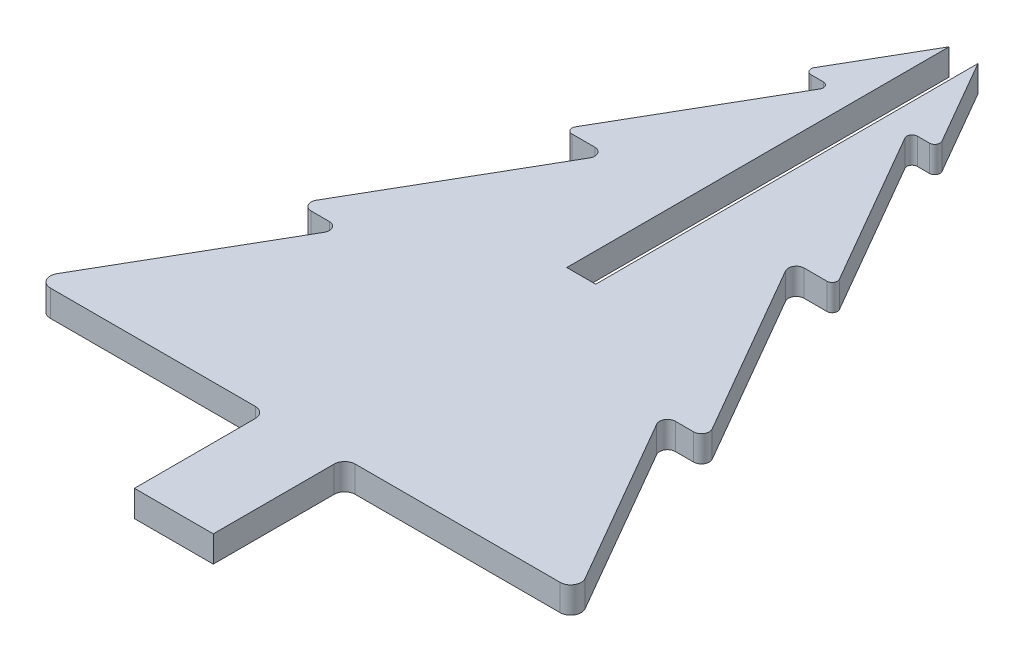
from build123d import *

# Parameters (mm, degrees)
ESBO_O1_W     = 15
ESBO_O1_H     = 25
RVORE_DEPTH   = 5
ESBO_O3_W     = 5.5
ESBO_O3_H     = 77.5
ENCAIXE_DEPTH = 5
FILETE1_R     = 1.5
FILETE2_R     = 1
FILETE3_R     = 1.5
FILETE4_R     = 1.5
FILETE5_R     = 2
FILETE6_R     = 1
FILETE7_R     = 1
FILETE8_R     = 2
FILETE9_R     = 1.5
FILETE10_R    = 1.5
FILETE11_R    = 1.5
FILETE12_R    = 1
FILETE13_R    = 1
FILETE14_R    = 1
FILETE15_R    = 2
FILETE16_R    = 2


with BuildPart() as part:
    # Esboço1 → rvore (new body)
    with BuildSketch(Plane(origin=(0, 0, 0), x_dir=(1, 0, 0), z_dir=(0, 1, 0))):
        with Locations((0, -127.5)):
            Rectangle(ESBO_O1_W, ESBO_O1_H)
        Polygon((-51.961524227, -115), (-7.5, -115), (7.5, -115), (51.961524227, -115), (30.310889132, -77.5), (-30.310889132, -77.5), align=None)
        Polygon((-8.660254038, -40), (-30.310889132, -77.5), (30.310889132, -77.5), (8.660254038, -40), align=None)
        Polygon((-17.320508076, -40), (-8.660254038, -40), (0, -25), (8.660254038, -40), (17.320508076, -40), (0, -10), align=None)
        Polygon((8.660254038, -40), (30.310889132, -77.5), (38.97114317, -77.5), (17.320508076, -40), align=None)
        Polygon((0, -25), (-8.660254038, -40), (8.660254038, -40), align=None)
        Polygon((-38.97114317, -77.5), (-30.310889132, -77.5), (-8.660254038, -40), (-17.320508076, -40), align=None)
        Polygon((-25.980762114, -40), (-17.320508076, -40), (0, -10), (17.320508076, -40), (25.980762114, -40), (7.216878365, -7.5), (-7.216878365, -7.5), align=None)
        Polygon((0, 5), (-7.216878365, -7.5), (7.216878365, -7.5), align=None)
        Polygon((-12.990381057, -7.5), (-7.216878365, -7.5), (0, 5), (7.216878365, -7.5), (12.990381057, -7.5), (0, 15), align=None)
    extrude(amount=RVORE_DEPTH)

    # Esboço3 → Encaixe (cut)
    with BuildSketch(Plane(origin=(0, 5, 0), x_dir=(1, 0, 0), z_dir=(0, 1, 0))):
        with Locations((0, -23.75)):
            Rectangle(ESBO_O3_W, ESBO_O3_H)
    extrude(amount=-ENCAIXE_DEPTH, mode=Mode.SUBTRACT)

    # Filete1
    filete1_edges = [part.edges().sort_by_distance(p)[0] for p in [
        (17.320508076, 2.5, 40),
    ]]
    fillet(filete1_edges, radius=FILETE1_R)

    # Filete2
    filete2_edges = [part.edges().sort_by_distance(p)[0] for p in [
        (25.980762114, 2.5, 40),
    ]]
    fillet(filete2_edges, radius=FILETE2_R)

    # Filete3
    filete3_edges = [part.edges().sort_by_distance(p)[0] for p in [
        (38.97114317, 2.5, 77.5),
    ]]
    fillet(filete3_edges, radius=FILETE3_R)

    # Filete4
    filete4_edges = [part.edges().sort_by_distance(p)[0] for p in [
        (30.310889132, 2.5, 77.5),
    ]]
    fillet(filete4_edges, radius=FILETE4_R)

    # Filete5
    filete5_edges = [part.edges().sort_by_distance(p)[0] for p in [
        (51.961524227, 2.5, 115),
    ]]
    fillet(filete5_edges, radius=FILETE5_R)

    # Filete6
    filete6_edges = [part.edges().sort_by_distance(p)[0] for p in [
        (12.990381057, 2.5, 7.5),
    ]]
    fillet(filete6_edges, radius=FILETE6_R)

    # Filete7
    filete7_edges = [part.edges().sort_by_distance(p)[0] for p in [
        (7.216878365, 2.5, 7.5),
    ]]
    fillet(filete7_edges, radius=FILETE7_R)

    # Filete8
    filete8_edges = [part.edges().sort_by_distance(p)[0] for p in [
        (-51.961524227, 2.5, 115),
    ]]
    fillet(filete8_edges, radius=FILETE8_R)

    # Filete9
    filete9_edges = [part.edges().sort_by_distance(p)[0] for p in [
        (-30.310889132, 2.5, 77.5),
    ]]
    fillet(filete9_edges, radius=FILETE9_R)

    # Filete10
    filete10_edges = [part.edges().sort_by_distance(p)[0] for p in [
        (-38.97114317, 2.5, 77.5),
    ]]
    fillet(filete10_edges, radius=FILETE10_R)

    # Filete11
    filete11_edges = [part.edges().sort_by_distance(p)[0] for p in [
        (-17.320508076, 2.5, 40),
    ]]
    fillet(filete11_edges, radius=FILETE11_R)

    # Filete12
    filete12_edges = [part.edges().sort_by_distance(p)[0] for p in [
        (-25.980762114, 2.5, 40),
    ]]
    fillet(filete12_edges, radius=FILETE12_R)

    # Filete13
    filete13_edges = [part.edges().sort_by_distance(p)[0] for p in [
        (-7.216878365, 2.5, 7.5),
    ]]
    fillet(filete13_edges, radius=FILETE13_R)

    # Filete14
    filete14_edges = [part.edges().sort_by_distance(p)[0] for p in [
        (-12.990381057, 2.5, 7.5),
    ]]
    fillet(filete14_edges, radius=FILETE14_R)

    # Filete15
    filete15_edges = [part.edges().sort_by_distance(p)[0] for p in [
        (-7.5, 2.5, 115),
    ]]
    fillet(filete15_edges, radius=FILETE15_R)

    # Filete16
    filete16_edges = [part.edges().sort_by_distance(p)[0] for p in [
        (7.5, 2.5, 115),
    ]]
    fillet(filete16_edges, radius=FILETE16_R)


solid = part.part
